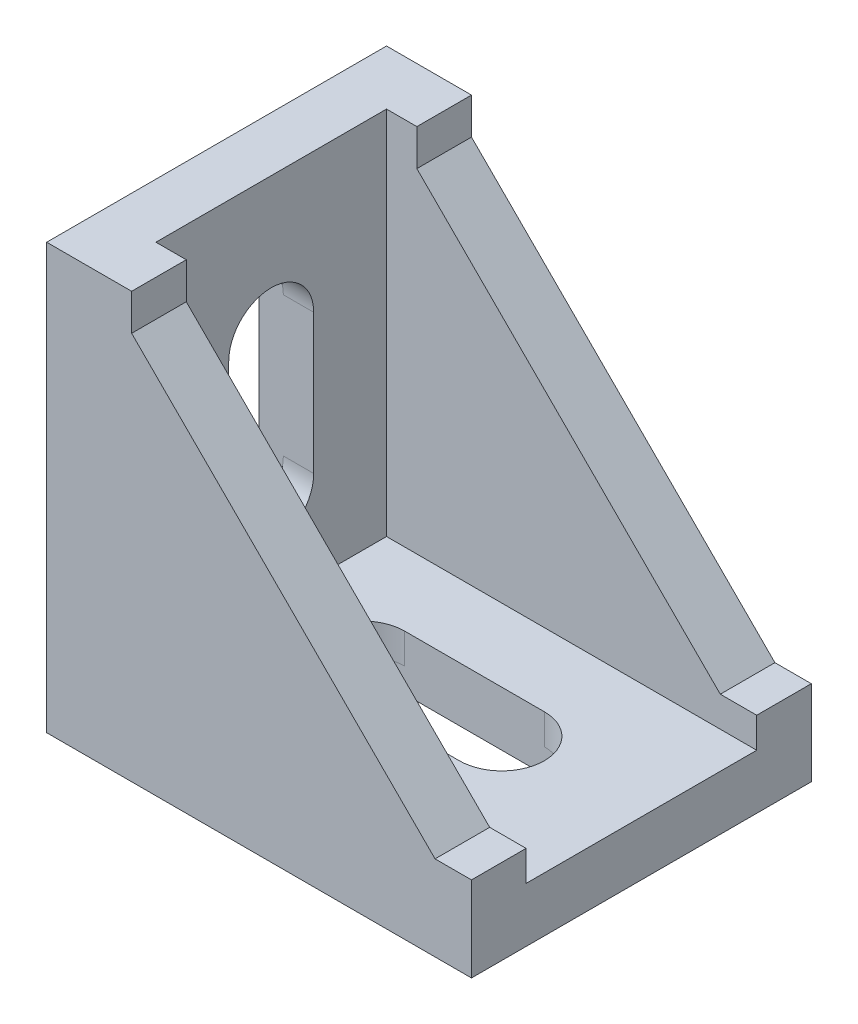
from build123d import *

# Parameters (mm, degrees)
SKETCH1_W           = 35
SKETCH1_H           = 28
BOSS_EXTRUDE1_DEPTH = 4.5
BOSS_EXTRUDE2_DEPTH = 4.5
SKETCH3_W           = 19
SKETCH3_H           = 30.5
BOSS_EXTRUDE3_DEPTH = 4.5
CUT_EXTRUDE1_DEPTH  = 4.5
SKETCH5_W           = 7
SKETCH5_H           = 23
SKETCH5_W_2         = 3
SKETCH5_H_2         = 30
CUT_EXTRUDE2_DEPTH  = 2
BOSS_EXTRUDE4_DEPTH = 3


with BuildPart() as part:
    # Sketch1 → Boss-Extrude1 (new body)
    with BuildSketch(Plane(origin=(0, 0, 0), x_dir=(1, 0, 0), z_dir=(0, 1, 0))):
        Rectangle(SKETCH1_W, SKETCH1_H)
        with BuildLine():
            Line((-5.5, 3.5), (6, 3.5))
            ThreePointArc((6, 3.5), (9.5, 0), (6, -3.5))
            Line((6, -3.5), (-5.5, -3.5))
            ThreePointArc((-5.5, -3.5), (-9, 0), (-5.5, 3.5))
        make_face(mode=Mode.SUBTRACT)
    extrude(amount=BOSS_EXTRUDE1_DEPTH)

    # Sketch2 → Boss-Extrude2 (add)
    with BuildSketch(Plane.XY.offset(14)):
        Polygon((17.5, 4.5), (17.5, 7), (14.5, 7), (-10.5, 32), (-10.5, 35), (-17.5, 35), (-17.5, 4.5), align=None)
    boss_extrude2 = extrude(amount=-BOSS_EXTRUDE2_DEPTH)

    # Mirror1: Boss-Extrude2 across plane
    add(boss_extrude2.mirror(Plane.XY))

    # Sketch3 → Boss-Extrude3 (add)
    with BuildSketch(Plane.ZY.offset(17.5)):
        with Locations((0, 19.75)):
            Rectangle(SKETCH3_W, SKETCH3_H)
    extrude(amount=-BOSS_EXTRUDE3_DEPTH)

    # Sketch4 → Cut-Extrude1 (cut)
    with BuildSketch(Plane.ZY.offset(17.5)):
        with BuildLine():
            Line((3.5, 23.5), (3.5, 12))
            ThreePointArc((3.5, 12), (0, 8.5), (-3.5, 12))
            Line((-3.5, 12), (-3.5, 23.5))
            ThreePointArc((-3.5, 23.5), (0, 27), (3.5, 23.5))
        make_face()
    cut_extrude1 = extrude(amount=-CUT_EXTRUDE1_DEPTH, mode=Mode.SUBTRACT)

    # Sketch5 → Cut-Extrude2 (cut)
    with BuildSketch(Plane.ZY.offset(17.5)):
        with Locations((0, 17.75)):
            Rectangle(SKETCH5_W, SKETCH5_H)
        with Locations((-10, 17.75)):
            Rectangle(SKETCH5_W_2, SKETCH5_H_2)
        with Locations((10, 17.75)):
            Rectangle(SKETCH5_W_2, SKETCH5_H_2)
    cut_extrude2 = extrude(amount=-CUT_EXTRUDE2_DEPTH, mode=Mode.SUBTRACT)

    # Sketch6 → Boss-Extrude4 (add, symmetric)
    with BuildSketch(Plane.XY):
        with BuildLine():
            Line((-17.5, 4.8), (-18.9, 4.8))
            ThreePointArc((-18.9, 4.8), (-19.08973666, 4.936754447), (-19.02, 5.16))
            Line((-19.02, 5.16), (-15.5, 7.8))
            Line((-15.5, 7.8), (-15.5, 4.8))
            Line((-15.5, 4.8), (-17.5, 4.8))
        make_face()
        with BuildLine():
            Line((-17.5, 29.25), (-19.017157288, 29.25))
            ThreePointArc((-19.017157288, 29.25), (-19.201933194, 29.373463314), (-19.158578644, 29.591421356))
            Line((-19.158578644, 29.591421356), (-17.5, 31.25))
            Line((-17.5, 31.25), (-17.5, 29.25))
        make_face()
    boss_extrude4 = extrude(amount=BOSS_EXTRUDE4_DEPTH, both=True)

    # Mirror2: Cut-Extrude1, Cut-Extrude2, Boss-Extrude4 across plane
    add(cut_extrude1.mirror(Plane(origin=(-8.75, 8.75, 0), x_dir=(0, 0, 1), z_dir=(-0.7071067811865475, 0.7071067811865477, 0))), mode=Mode.SUBTRACT)
    add(cut_extrude2.mirror(Plane(origin=(-8.75, 8.75, 0), x_dir=(0, 0, 1), z_dir=(-0.7071067811865475, 0.7071067811865477, 0))), mode=Mode.SUBTRACT)
    add(boss_extrude4.mirror(Plane(origin=(-8.75, 8.75, 0), x_dir=(0, 0, 1), z_dir=(-0.7071067811865475, 0.7071067811865477, 0))))


solid = part.part
